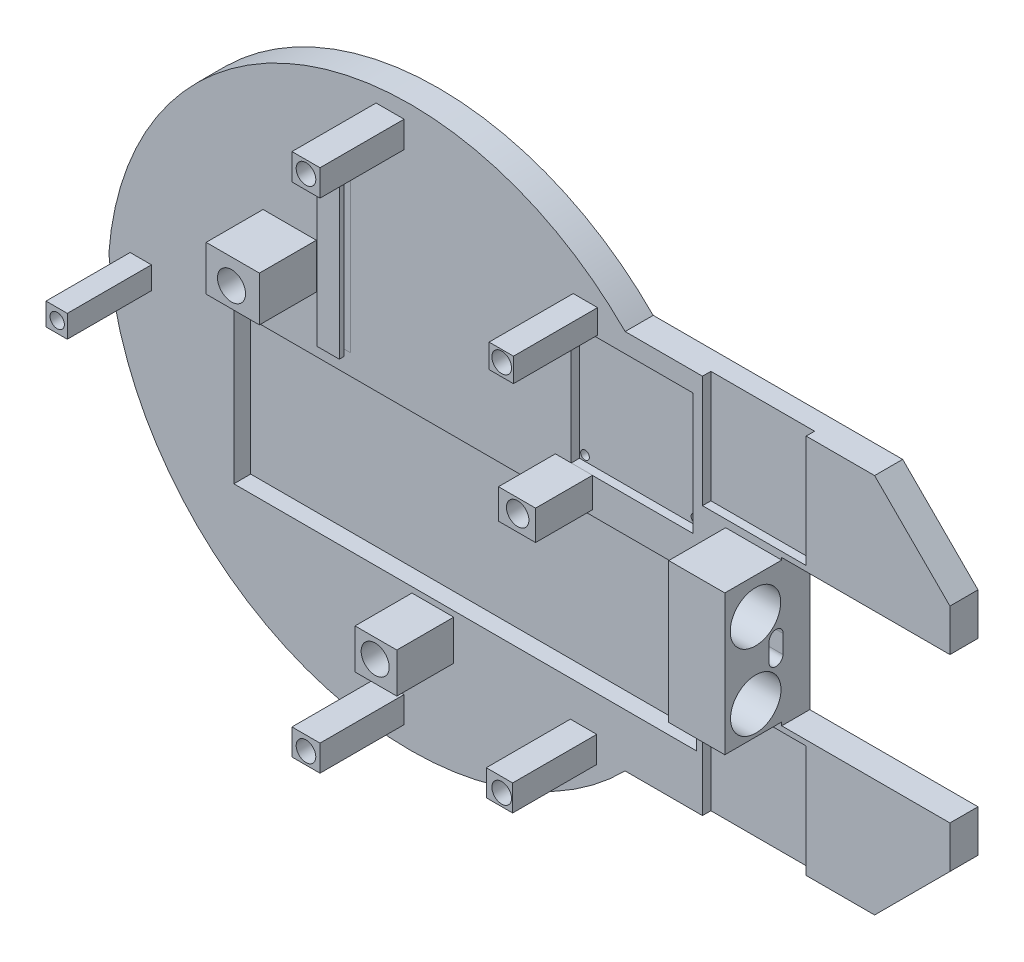
from build123d import *

# Parameters (mm, degrees)
BOSS_EXTRUDE1_DEPTH      = 10
BOSS_EXTRUDE1_DEPTH_BACK = 0.01
SKETCH3_W                = 37
SKETCH3_H                = 40
CUT_EXTRUDE1_DEPTH       = 3
SKETCH5_W                = 37
SKETCH5_H                = 40
CUT_EXTRUDE3_DEPTH       = 3
SKETCH7_W                = 165
SKETCH7_H                = 54
CUT_EXTRUDE4_DEPTH       = 6
SKETCH9_W                = 19
SKETCH9_H                = 16
SKETCH9_W_2              = 13.23867097
SKETCH9_H_2              = 10.64338859
SKETCH9_W_3              = 14.8958404
SKETCH9_H_3              = 14.23867097
BOSS_EXTRUDE2_DEPTH      = 20.3
SKETCH15_W               = 20
SKETCH15_H               = 50
BOSS_EXTRUDE3_DEPTH      = 20.3
SKETCH16_W               = 7.597238681
SKETCH16_H               = 8
SKETCH16_W_2             = 10
SKETCH16_H_2             = 9.4
SKETCH16_W_3             = 8.7
SKETCH16_H_3             = 8.5
SKETCH16_W_4             = 9.4
SKETCH16_H_4             = 9.3
BOSS_EXTRUDE4_DEPTH      = 30
SKETCH17_R               = 2.55
SKETCH17_R_2             = 3.5
CUT_EXTRUDE17_DEPTH      = 263.98121496
SKETCH18_W               = 43.4
SKETCH18_H               = 43.4
CUT_EXTRUDE18_DEPTH      = 3
SKETCH20_R               = 5
SKETCH20_R_2             = 4
CUT_EXTRUDE20_DEPTH      = 263.98121496
SKETCH21_R               = 9
CUT_EXTRUDE21_DEPTH      = 20
SKETCH22_R               = 1.55
CUT_EXTRUDE23_DEPTH      = 263.007861374
SKETCH25_W               = 7.9
SKETCH25_H               = 58.5
BOSS_EXTRUDE5_DEPTH      = 4
SKETCH26_W               = 7.816347336
SKETCH26_H               = 2.399791276
CUT_EXTRUDE24_DEPTH      = 58.5


with BuildPart() as part:
    # Sketch1 → Boss-Extrude1 (new, two sides: drawn at the far end of the back side and taken through both)
    with BuildSketch(Plane.XY.offset(-BOSS_EXTRUDE1_DEPTH_BACK)):
        with BuildLine():
            Line((0, 0), (0, -26))
            Line((0, -26), (60, -26))
            Line((60, -26), (60, -41))
            Line((60, -41), (33.129942315, -67.870057685))
            Line((33.129942315, -67.870057685), (-55.850057685, -67.870057685))
            ThreePointArc((-55.850057685, -67.870057685), (-169.745893523, -93.14097487), (-240, 0))
            ThreePointArc((-240, 0), (-169.745893523, 93.14097487), (-55.850057685, 67.870057685))
            Line((-55.850057685, 67.870057685), (33.129942315, 67.870057685))
            Line((33.129942315, 67.870057685), (60, 41))
            Line((60, 41), (60, 26))
            Line((60, 26), (0, 26))
            Line((0, 26), (0, 0))
        make_face()
    extrude(amount=BOSS_EXTRUDE1_DEPTH + BOSS_EXTRUDE1_DEPTH_BACK)

    # Sketch3 → Cut-Extrude1 (cut)
    with BuildSketch(Plane.XY.offset(10)):
        with Locations((-9.773002586, 47.870057685)):
            Rectangle(SKETCH3_W, SKETCH3_H)
    extrude(amount=-CUT_EXTRUDE1_DEPTH, mode=Mode.SUBTRACT)

    # Sketch5 → Cut-Extrude3 (cut)
    with BuildSketch(Plane.XY.offset(10)):
        with Locations((-9.773002586, -47.870057685)):
            Rectangle(SKETCH5_W, SKETCH5_H)
    extrude(amount=-CUT_EXTRUDE3_DEPTH, mode=Mode.SUBTRACT)

    # Sketch7 → Cut-Extrude4 (cut)
    with BuildSketch(Plane.XY.offset(10)):
        with Locations((-112.913094129, -21.943838981)):
            Rectangle(SKETCH7_W, SKETCH7_H)
    extrude(amount=-CUT_EXTRUDE4_DEPTH, mode=Mode.SUBTRACT)

    # Sketch9 → Boss-Extrude2 (add)
    with BuildSketch(Plane.XY.offset(10)):
        with Locations((-175.5, 33)):
            Rectangle(SKETCH9_W, SKETCH9_H)
        with Locations((-74.112324575, 12.332539195)):
            Rectangle(SKETCH9_W_2, SKETCH9_H_2)
        with Locations((-124.438795754, -58.044490005)):
            Rectangle(SKETCH9_W_3, SKETCH9_H_3)
    extrude(amount=BOSS_EXTRUDE2_DEPTH)

    # Sketch15 → Boss-Extrude3 (add)
    with BuildSketch(Plane.XY.offset(10)):
        with Locations((-10, 0.20156489)):
            Rectangle(SKETCH15_W, SKETCH15_H)
    extrude(amount=BOSS_EXTRUDE3_DEPTH)

    # Sketch16 → Boss-Extrude4 (add)
    with BuildSketch(Plane.XY.offset(10)):
        with Locations((-228.62215183, 0)):
            Rectangle(SKETCH16_W, SKETCH16_H)
        with Locations((-139.68812176, 89.3492876)):
            Rectangle(SKETCH16_W_2, SKETCH16_H_2)
        with Locations((-70.02791219, 66.09880262)):
            Rectangle(SKETCH16_W_3, SKETCH16_H_3)
        with Locations((-70.67791219, -66.2732878)):
            Rectangle(SKETCH16_W_4, SKETCH16_H_4)
        with Locations((-139.68812176, -88.33151307)):
            Rectangle(SKETCH16_W_2, SKETCH16_H_4)
    extrude(amount=BOSS_EXTRUDE4_DEPTH)

    # Sketch17 → Cut-Extrude17 (cut, through all)
    with BuildSketch(Plane.XY):
        with Locations((-228.42077117, 0)):
            Circle(SKETCH17_R)
        with Locations((-139.68812176, 89.6492876)):
            Circle(SKETCH17_R_2)
        with Locations((-69.87791219, 66.34880262)):
            Circle(SKETCH17_R_2)
        with Locations((-69.87791219, -66.6232878)):
            Circle(SKETCH17_R_2)
        with Locations((-139.68812176, -88.68151307)):
            Circle(SKETCH17_R_2)
    extrude(amount=CUT_EXTRUDE17_DEPTH, mode=Mode.SUBTRACT)

    # Sketch18 → Cut-Extrude18 (cut)
    with BuildSketch(Plane.XY.offset(10)):
        with Locations((-53.424548955, 39.3)):
            Rectangle(SKETCH18_W, SKETCH18_H)
    extrude(amount=-CUT_EXTRUDE18_DEPTH, mode=Mode.SUBTRACT)

    # Sketch20 → Cut-Extrude20 (cut, through all)
    with BuildSketch(Plane.XY):
        with Locations((-175.947050483, 32.112084796)):
            Circle(SKETCH20_R)
        with Locations((-124.709385772, -57.612858016)):
            Circle(SKETCH20_R)
        with Locations((-73.8879152, 12.75038661)):
            Circle(SKETCH20_R_2)
    extrude(amount=CUT_EXTRUDE20_DEPTH, mode=Mode.SUBTRACT)

    # Sketch21 → Cut-Extrude21 (cut)
    with BuildSketch(Plane(origin=(0, 0, 0), x_dir=(0, 0, -1), z_dir=(1, 0, 0))):
        with Locations((-19.36187505, 12.37175029)):
            Circle(SKETCH21_R)
        with Locations((-19.26539558, -14.62824971)):
            Circle(SKETCH21_R)
        with BuildLine():
            Line((-9.491579533, 2.276446619), (-9.557448357, -4.178698144))
            ThreePointArc((-9.557448357, -4.178698144), (-12.081396215, -6.651657156), (-14.554355227, -4.127709299))
            Line((-14.554355227, -4.127709299), (-14.488486403, 2.327435464))
            ThreePointArc((-14.488486403, 2.327435464), (-11.964538545, 4.800394476), (-9.491579533, 2.276446619))
        make_face()
    extrude(amount=-CUT_EXTRUDE21_DEPTH, mode=Mode.SUBTRACT)

    # Sketch22 → Cut-Extrude23 (cut, through all)
    with BuildSketch(Plane.XY.offset(7)):
        with Locations((-73.168620443, 58.97947337)):
            Circle(SKETCH22_R)
        with Locations((-33.768620443, 58.97947337)):
            Circle(SKETCH22_R)
        with Locations((-33.768620443, 19.57947337)):
            Circle(SKETCH22_R)
        with Locations((-73.168620443, 19.57947337)):
            Circle(SKETCH22_R)
    extrude(amount=-CUT_EXTRUDE23_DEPTH, mode=Mode.SUBTRACT)

    # Sketch25 → Boss-Extrude5 (add)
    with BuildSketch(Plane.XY.offset(10)):
        with Locations((-157.74640613, 41.59949177)):
            Rectangle(SKETCH25_W, SKETCH25_H)
    extrude(amount=BOSS_EXTRUDE5_DEPTH)

    # Sketch26 → Cut-Extrude24 (cut)
    with BuildSketch(Plane.XZ.offset(-12.34949177)):
        with Locations((-157.704579798, 11.208428435)):
            Rectangle(SKETCH26_W, SKETCH26_H)
    extrude(amount=-CUT_EXTRUDE24_DEPTH, mode=Mode.SUBTRACT)


solid = part.part
